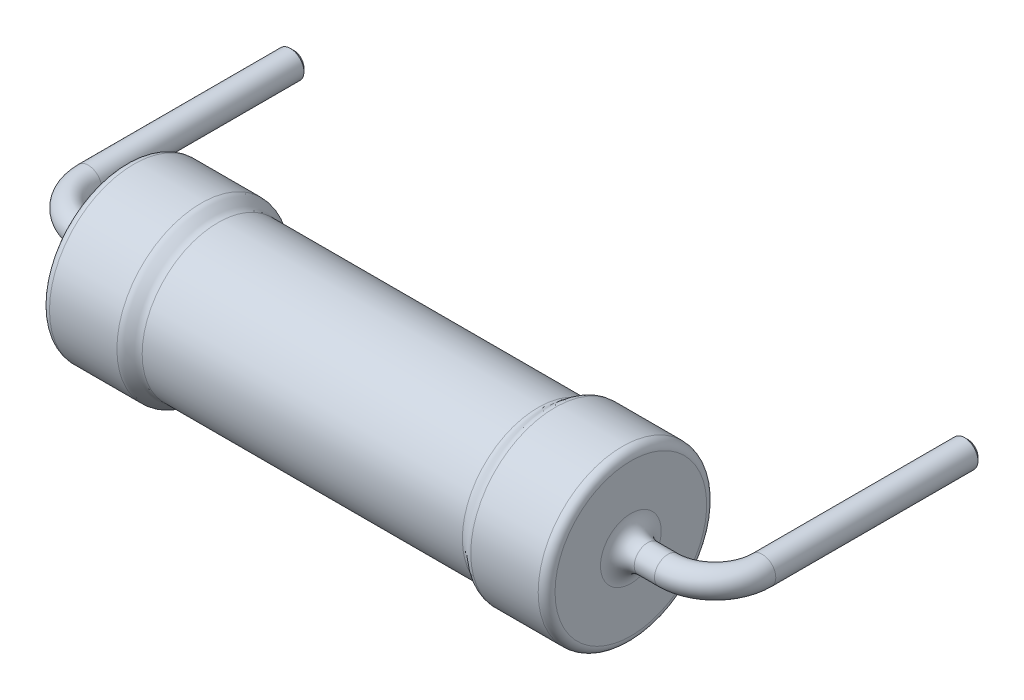
from build123d import *

# Parameters (mm, degrees)
SKETCH_3_R                 = 0.4
CHAMFER_1_SIZE             = 0.1
CHAMFER_1_OF_MIRROR_1_SIZE = 0.1


with BuildPart() as part:
    # Эскиз1 → Повернуть1 (revolve)
    with BuildSketch(Plane(origin=(0, 0, 0), x_dir=(1, 0, 0), z_dir=(0, 1, 0)), mode=Mode.PRIVATE) as revolve_1_sk:
        with BuildLine():
            Line((-8, -4.5), (8, -4.5))
            Line((8, -4.5), (8, -4.1))
            ThreePointArc((8, -4.1), (7.646446609, -3.953553391), (7.5, -3.6))
            Line((7.5, -3.6), (7.5, -2.25))
            ThreePointArc((7.5, -2.25), (7.426776695, -2.073223305), (7.25, -2))
            Line((7.25, -2), (5.25, -2))
            add(Edge.make_bspline(
                [(5.25, -2), (5.138483771, -2), (5.001208755, -2.125), (4.859098719, -2.25), (4.75, -2.25)],
                knots=[0, 0, 0, 0, 0.5, 1, 1, 1, 1], degree=3))
            Line((4.75, -2.25), (-4.75, -2.25))
            add(Edge.make_bspline(
                [(-5.25, -2), (-5.138483771, -2), (-5.001208755, -2.125), (-4.859098719, -2.25), (-4.75, -2.25)],
                knots=[0, 0, 0, 0, 0.5, 1, 1, 1, 1], degree=3))
            Line((-5.25, -2), (-7.25, -2))
            ThreePointArc((-7.25, -2), (-7.426776695, -2.073223305), (-7.5, -2.25))
            Line((-7.5, -2.25), (-7.5, -3.6))
            ThreePointArc((-7.5, -3.6), (-7.646446609, -3.953553391), (-8, -4.1))
            Line((-8, -4.1), (-8, -4.5))
        make_face()
    revolve(revolve_1_sk.sketch.rotate(Axis((-11.456266602, 0, 4.5), (1, 0, 0)), 180), axis=Axis((-11.456266602, 0, 4.5), (1, 0, 0)))

    # По траектории1: sweep along a path in Эскиз2
    with BuildLine(Plane(origin=(0, 0, 0), x_dir=(1, 0, 0), z_dir=(0, 1, 0))) as sweep_1_path:
        Line((-8, -4.5), (-8.6, -4.5))
        ThreePointArc((-8.6, -4.5), (-9.589949494, -4.089949494), (-10, -3.1))
        Line((-10, -3.1), (-10, 3))
    # Эскиз3 → По траектории1 (sweep)
    with BuildSketch(Plane.ZY.offset(8)):
        with Locations((4.5, 0)):
            Circle(SKETCH_3_R)
    sweep_1 = sweep(path=sweep_1_path.line)

    # Фаска1
    chamfer_1_edges = [part.edges().sort_by_distance(p)[0] for p in [
        (-9.6, 0, -3),
    ]]
    chamfer(chamfer_1_edges, length=CHAMFER_1_SIZE)

    # Зеркальное отражение1: По траектории1 across plane
    add(sweep_1.mirror(Plane(origin=(0, 0, 0), x_dir=(0, 0, 1), z_dir=(1, 0, 0))))

    # Фаска1 of Зеркальное отражение1
    chamfer_1_of_mirror_1_edges = [part.edges().sort_by_distance(p)[0] for p in [
        (9.6, 0, -3),
    ]]
    chamfer(chamfer_1_of_mirror_1_edges, length=CHAMFER_1_OF_MIRROR_1_SIZE)


solid = part.part
